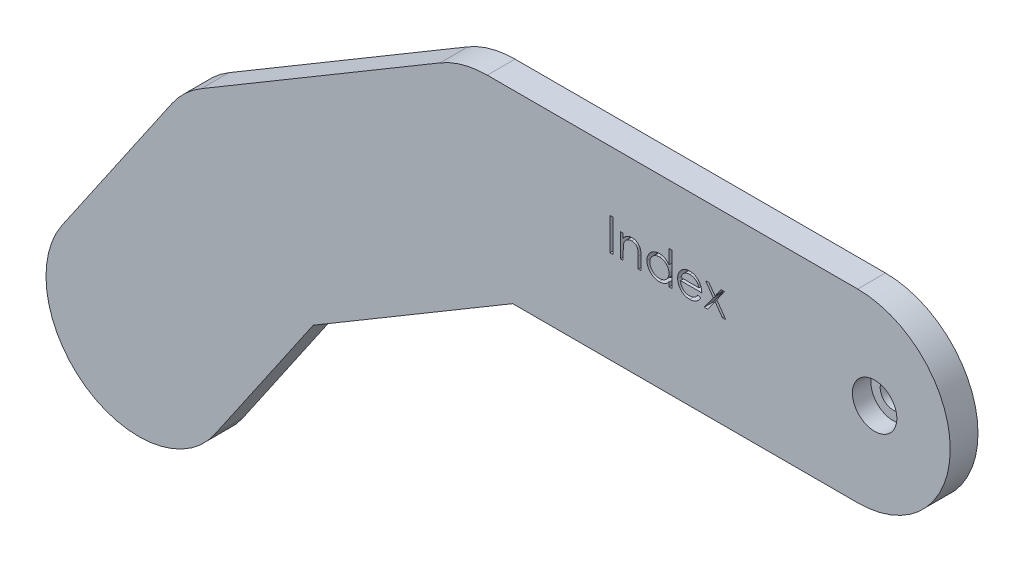
from build123d import *

# Parameters (mm, degrees)
BOSS_EXTRUDE1_DEPTH = 3
BOSS_EXTRUDE2_DEPTH = 3
BOSS_EXTRUDE4_DEPTH = 3
SKETCH4_R           = 1.4
CUT_EXTRUDE5_DEPTH  = 3
SKETCH5_R           = 2.4
CUT_EXTRUDE6_DEPTH  = 2
SKETCH7_W           = 0.314102564
SKETCH7_H           = 3.5
CUT_EXTRUDE7_DEPTH  = 1


with BuildPart() as part:
    # Sketch1 → Boss-Extrude1 (new body)
    with BuildSketch(Plane.XY):
        with BuildLine():
            Line((0, 10), (40, 10))
            ThreePointArc((40, 10), (50, 0), (40, -10))
            Line((40, -10), (0, -10))
            ThreePointArc((0, -10), (-10, 0), (0, 10))
        make_face()
    extrude(amount=BOSS_EXTRUDE1_DEPTH)

    # Sketch2 → Boss-Extrude2 (add)
    with BuildSketch(Plane.XY):
        with BuildLine():
            Line((5.104260767, -8.599216361), (-20.693388315, -23.911998663))
            ThreePointArc((-20.693388315, -23.911998663), (-34.396865443, -20.417043069), (-30.90190985, -6.713565941))
            Line((-30.90190985, -6.713565941), (-5.104260767, 8.599216361))
            ThreePointArc((-5.104260767, 8.599216361), (8.599216361, 5.104260767), (5.104260767, -8.599216361))
        make_face()
    extrude(amount=BOSS_EXTRUDE2_DEPTH)

    # Sketch3 → Boss-Extrude4 (add)
    with BuildSketch(Plane.XY):
        with BuildLine():
            Line((-17.548569958, -20.965453669), (-29.412835261, -38.27926105))
            ThreePointArc((-29.412835261, -38.27926105), (-43.314585753, -40.875668807), (-45.910993511, -26.973918315))
            Line((-45.910993511, -26.973918315), (-34.046728207, -9.660110934))
            ThreePointArc((-34.046728207, -9.660110934), (-20.144977715, -7.063703177), (-17.548569958, -20.965453669))
        make_face()
    extrude(amount=BOSS_EXTRUDE4_DEPTH)

    # Sketch4 → Cut-Extrude5 (cut)
    with BuildSketch(Plane.XY):
        with Locations((41.835442891, 0)):
            Circle(SKETCH4_R)
    extrude(amount=CUT_EXTRUDE5_DEPTH, mode=Mode.SUBTRACT)

    # Sketch5 → Cut-Extrude6 (cut)
    with BuildSketch(Plane.XY.offset(3)):
        with Locations((41.835442891, 0)):
            Circle(SKETCH5_R)
    extrude(amount=-CUT_EXTRUDE6_DEPTH, mode=Mode.SUBTRACT)

    # Sketch7 → Cut-Extrude7 (cut)
    # profile 1 of 5: a face of its own
    with BuildSketch(Plane.XY.offset(3)):
        with Locations((13.404825066, 1.760445417)):
            Rectangle(SKETCH7_W, SKETCH7_H)
    # profile 2 of 5: a face of its own
    with BuildSketch(Plane.XY.offset(3)):
        with BuildLine():
            Line((14.369568655, 2.568137725), (14.683671219, 2.568137725))
            Line((14.683671219, 2.568137725), (14.683671219, 2.106799584))
            add(Edge.make_bspline(
                [(14.683671219, 2.106799584), (14.717208855, 2.148642307), (14.782289806, 2.22983957), (14.890674139, 2.336560145), (15.005218039, 2.42450537), (15.125220043, 2.494609164), (15.250843053, 2.54745579), (15.381321323, 2.585621721), (15.517436029, 2.60850655), (15.610000466, 2.61149678), (15.656828271, 2.61300952)],
                knots=[0, 0, 0, 0, 1.12780773, 2.188550248, 3.19190651, 4.159438251, 5.104880172, 6.052711206, 7.014878035, 8, 8, 8, 8], degree=3))
            add(Edge.make_bspline(
                [(15.656828271, 2.61300952), (15.704158905, 2.611264325), (15.796796373, 2.607848556), (15.931674434, 2.580831865), (16.057647828, 2.53468661), (16.174267383, 2.471474539), (16.279394597, 2.392868066), (16.371719448, 2.301290284), (16.448082696, 2.195954201), (16.499280059, 2.098231045), (16.533005706, 2.011542251), (16.554238044, 1.9372955), (16.572269025, 1.854577349), (16.587900773, 1.76363776), (16.598477885, 1.66383957), (16.606820177, 1.555591878), (16.612798871, 1.438929747), (16.613036078, 1.35824312), (16.613158399, 1.316635321)],
                knots=[0, 0, 0, 0, 1.235846778, 2.418850247, 3.575807741, 4.728682307, 5.871620074, 6.994088408, 8.11269785, 9.256955736, 9.865816715, 10.540099792, 11.271859618, 12.076849838, 12.949306005, 13.892391288, 14.913166135, 16, 16, 16, 16], degree=3))
            Line((16.613158399, 1.316635321), (16.613158399, 0.010445417))
            Line((16.613158399, 0.010445417), (16.299055835, 0.010445417))
            Line((16.299055835, 0.010445417), (16.299055835, 1.213570417))
            add(Edge.make_bspline(
                [(16.299055835, 1.213570417), (16.298862627, 1.248392862), (16.298493053, 1.315002273), (16.297327406, 1.410371296), (16.294517599, 1.496857875), (16.290569287, 1.574255242), (16.284790256, 1.642489079), (16.278767625, 1.701698355), (16.271402648, 1.751807898), (16.264839735, 1.78197298), (16.26189638, 1.795501507)],
                knots=[0, 0, 0, 0, 1.430800155, 2.736877192, 3.918605307, 4.986035426, 5.920637409, 6.731861385, 7.431261377, 8, 8, 8, 8], degree=3))
            add(Edge.make_bspline(
                [(16.26189638, 1.795501507), (16.251270848, 1.835212692), (16.230819988, 1.911644437), (16.180286004, 2.015318789), (16.116471824, 2.103516977), (16.038573974, 2.175693699), (15.947344899, 2.231864536), (15.843037756, 2.27083849), (15.726659115, 2.295214759), (15.644804732, 2.297641891), (15.602140771, 2.298906956)],
                knots=[0, 0, 0, 0, 1.084156227, 2.086665306, 3.027808233, 3.945421172, 4.874247719, 5.839848303, 6.874090471, 8, 8, 8, 8], degree=3))
            add(Edge.make_bspline(
                [(15.602140771, 2.298906956), (15.576873087, 2.298430951), (15.526868994, 2.29748895), (15.452719022, 2.288037652), (15.380794849, 2.272579197), (15.31037464, 2.251710559), (15.242866846, 2.22304829), (15.176102555, 2.19051892), (15.112595791, 2.149970708), (15.050992394, 2.104780086), (14.993679586, 2.054700879), (14.940351248, 2.001856369), (14.892813228, 1.945580765), (14.849744552, 1.886780818), (14.812566289, 1.82464898), (14.780113201, 1.759784673), (14.752577506, 1.692102524), (14.738894814, 1.645127463), (14.732048623, 1.621623302)],
                knots=[0, 0, 0, 0, 1.023777757, 2.026029729, 3.023749952, 4.003683103, 4.997618607, 5.993177895, 7.010360494, 8.046726602, 9.087585522, 10.09234134, 11.086953743, 12.070360549, 13.043493632, 14.017870808, 15.008233677, 16, 16, 16, 16], degree=3))
            add(Edge.make_bspline(
                [(14.732048623, 1.621623302), (14.728108975, 1.604368099), (14.719532566, 1.566804425), (14.710269386, 1.505160005), (14.701861811, 1.43385003), (14.694824852, 1.352957713), (14.690519435, 1.262199838), (14.685825039, 1.161964), (14.684115978, 1.051850512), (14.683823624, 0.975188819), (14.683671219, 0.935225065)],
                knots=[0, 0, 0, 0, 0.615963638, 1.340920617, 2.168419149, 3.115676021, 4.16674242, 5.331190069, 6.6087489, 8, 8, 8, 8], degree=3))
            Line((14.683671219, 0.935225065), (14.683671219, 0.010445417))
            Line((14.683671219, 0.010445417), (14.369568655, 0.010445417))
            Line((14.369568655, 0.010445417), (14.369568655, 2.568137725))
        make_face()
    # profile 3 of 5: a face of its own
    with BuildSketch(Plane.XY.offset(3)):
        with BuildLine():
            Line((19.933671219, 3.600189007), (19.933671219, 0.010445417))
            Line((19.933671219, 0.010445417), (19.619568655, 0.010445417))
            Line((19.619568655, 0.010445417), (19.619568655, 0.45285327))
            add(Edge.make_bspline(
                [(19.619568655, 0.45285327), (19.584149865, 0.412813676), (19.515029649, 0.334675905), (19.399588531, 0.232593732), (19.277220354, 0.148215411), (19.148519032, 0.080065495), (19.013600789, 0.028873439), (18.872764702, -0.00751272), (18.725953321, -0.030906555), (18.625700966, -0.033242577), (18.574897181, -0.034426377)],
                knots=[0, 0, 0, 0, 1.074387032, 2.096679803, 3.090159297, 4.057316773, 5.018401886, 5.985159533, 6.978961417, 8, 8, 8, 8], degree=3))
            add(Edge.make_bspline(
                [(18.574897181, -0.034426377), (18.529729227, -0.033200005), (18.440656022, -0.030781545), (18.309626945, -0.012019241), (18.183534696, 0.01811138), (18.062260123, 0.06001227), (17.946587978, 0.115593092), (17.835527881, 0.18213434), (17.729655189, 0.26137517), (17.63058365, 0.351963198), (17.53935165, 0.450358185), (17.459290377, 0.555303732), (17.392537297, 0.666346036), (17.336717216, 0.78207919), (17.293720872, 0.903394109), (17.263747238, 1.029871277), (17.245006791, 1.161361151), (17.24258933, 1.250900674), (17.241363527, 1.296302789)],
                knots=[0, 0, 0, 0, 1.033919861, 2.038935746, 3.024066025, 3.998881131, 4.97069526, 5.957263378, 6.95902576, 7.993208707, 9.027059324, 10.027763471, 11.009749337, 11.988697705, 12.965288445, 13.950418724, 14.960734635, 16, 16, 16, 16], degree=3))
            add(Edge.make_bspline(
                [(17.241363527, 1.296302789), (17.242616499, 1.340766493), (17.245093555, 1.428668836), (17.263546775, 1.557947534), (17.294577784, 1.682465795), (17.338125632, 1.801822738), (17.393967586, 1.916162788), (17.461895673, 2.025566813), (17.541914798, 2.130336211), (17.634167205, 2.228007437), (17.734101975, 2.318228052), (17.841010706, 2.396637097), (17.952233988, 2.464353946), (18.069496998, 2.518007422), (18.191064103, 2.561416527), (18.318017549, 2.591449495), (18.449829127, 2.609146816), (18.539319619, 2.61170958), (18.584712886, 2.61300952)],
                knots=[0, 0, 0, 0, 1.020392517, 2.01726096, 2.990465484, 3.961182959, 4.928053699, 5.906110375, 6.912531644, 7.948652711, 8.985773172, 9.998621852, 10.987621588, 11.969261332, 12.953316658, 13.946091881, 14.958173133, 16, 16, 16, 16], degree=3))
            add(Edge.make_bspline(
                [(18.584712886, 2.61300952), (18.636929694, 2.611442424), (18.739425484, 2.608366389), (18.889324006, 2.582660022), (19.031111617, 2.539497144), (19.165604604, 2.480405862), (19.292001164, 2.403605111), (19.411227805, 2.310853663), (19.521211128, 2.199526517), (19.58628295, 2.115914944), (19.619568655, 2.073145738)],
                knots=[0, 0, 0, 0, 1.031072012, 2.023879775, 2.993683497, 3.952812103, 4.918022106, 5.908088563, 6.929940113, 8, 8, 8, 8], degree=3))
            Line((19.619568655, 2.073145738), (19.619568655, 3.600189007))
            Line((19.619568655, 3.600189007), (19.933671219, 3.600189007))
        make_face()
        with BuildLine():
            add(Edge.make_bspline(
                [(18.588919617, 2.298906956), (18.543005279, 2.297273318), (18.452377679, 2.294048777), (18.319333677, 2.268875282), (18.192020263, 2.226990688), (18.071074189, 2.169708786), (17.958405972, 2.09768005), (17.857712301, 2.010558666), (17.7681696, 1.910721652), (17.692861336, 1.798619542), (17.631470839, 1.678441451), (17.588303807, 1.552817013), (17.559834559, 1.424012035), (17.556926039, 1.336649349), (17.555466091, 1.29279718)],
                knots=[0, 0, 0, 0, 1.031046209, 2.035121221, 3.029706178, 4.034933723, 5.034054252, 6.02443088, 7.017295772, 8.038157696, 9.050218397, 10.03989886, 11.016116709, 12, 12, 12, 12], degree=3))
            add(Edge.make_bspline(
                [(17.555466091, 1.29279718), (17.557330985, 1.249207073), (17.561053461, 1.162197717), (17.587804156, 1.03321714), (17.632684029, 0.907563098), (17.693926092, 0.786302105), (17.770612717, 0.673718004), (17.859501369, 0.571977882), (17.961451651, 0.484488294), (18.074379158, 0.41125072), (18.194987128, 0.352088199), (18.32182106, 0.31092256), (18.452496698, 0.284344779), (18.541349032, 0.281240302), (18.58611513, 0.279676187)],
                knots=[0, 0, 0, 0, 0.979072187, 1.954306742, 2.945804271, 3.96968567, 4.997920485, 5.998718438, 6.996577872, 8.005894225, 9.015743152, 10.005417472, 10.995077863, 12, 12, 12, 12], degree=3))
            add(Edge.make_bspline(
                [(18.58611513, 0.279676187), (18.631561632, 0.281336151), (18.721950219, 0.284637654), (18.855388927, 0.309918919), (18.98488389, 0.351687718), (19.108671118, 0.409586845), (19.223987249, 0.4813442), (19.327485127, 0.565351291), (19.415001095, 0.663054476), (19.489193705, 0.770430929), (19.547369121, 0.888142925), (19.589745181, 1.013477116), (19.614799086, 1.146437864), (19.617956816, 1.237301791), (19.619568655, 1.283682597)],
                knots=[0, 0, 0, 0, 1.01762866, 2.023962475, 3.030623092, 4.058876274, 5.077231937, 6.066672613, 7.034107872, 8.005628644, 8.981990164, 9.965428785, 10.961468474, 12, 12, 12, 12], degree=3))
            add(Edge.make_bspline(
                [(19.619568655, 1.283682597), (19.618608999, 1.319020427), (19.616720092, 1.388576461), (19.602289522, 1.490703978), (19.579334596, 1.588437704), (19.546988426, 1.681880393), (19.504497141, 1.770515409), (19.453249375, 1.854979169), (19.392343926, 1.93483238), (19.322761229, 2.008975451), (19.246596027, 2.076601914), (19.166001486, 2.136966154), (19.080022739, 2.186554927), (18.990105702, 2.227596199), (18.896094368, 2.260255348), (18.797223748, 2.282043042), (18.694544761, 2.297003363), (18.624498706, 2.298265744), (18.588919617, 2.298906956)],
                knots=[0, 0, 0, 0, 1.050140795, 2.067009409, 3.05949893, 4.030605086, 5.00011959, 5.97591094, 6.962425594, 7.979863591, 8.993523472, 9.986985069, 10.967611495, 11.937549037, 12.921786183, 13.919465291, 14.943216303, 16, 16, 16, 16], degree=3))
        make_face(mode=Mode.SUBTRACT)
    # profile 4 of 5: a face of its own
    with BuildSketch(Plane.XY.offset(3)):
        with BuildLine():
            Line((22.750778591, 0.818137725), (23.029825066, 0.67160327))
            add(Edge.make_bspline(
                [(23.029825066, 0.67160327), (23.00758847, 0.632159939), (22.964324862, 0.555418836), (22.889924114, 0.449986975), (22.811932041, 0.35513926), (22.726828073, 0.273409605), (22.637158394, 0.20215822), (22.54242574, 0.139820396), (22.442136922, 0.086701875), (22.336287197, 0.041949347), (22.223987646, 0.007539853), (22.10496613, -0.016764368), (21.978994634, -0.031787636), (21.892648454, -0.033532777), (21.848434841, -0.034426377)],
                knots=[0, 0, 0, 0, 1.120438281, 2.179929193, 3.190490725, 4.156257408, 5.095198341, 6.022838206, 6.959905092, 7.901321166, 8.864066838, 9.862729781, 10.905609505, 12, 12, 12, 12], degree=3))
            add(Edge.make_bspline(
                [(21.848434841, -0.034426377), (21.799292864, -0.033279202), (21.703431102, -0.031041395), (21.563891355, -0.011748931), (21.432511937, 0.019723428), (21.309300233, 0.063688969), (21.194557981, 0.121116293), (21.088057126, 0.191075775), (20.9892376, 0.27320803), (20.901213391, 0.368224473), (20.821969508, 0.469906431), (20.752043688, 0.575862315), (20.693586257, 0.68582554), (20.646033647, 0.799096064), (20.607628782, 0.914959957), (20.580862078, 1.034471425), (20.56543233, 1.157307009), (20.563067885, 1.240404345), (20.561876348, 1.282280353)],
                knots=[0, 0, 0, 0, 1.145258523, 2.234067595, 3.276747158, 4.290159414, 5.277019952, 6.260822364, 7.254936242, 8.264827045, 9.274100331, 10.257902744, 11.220704747, 12.172965371, 13.118907548, 14.062713208, 15.023725156, 16, 16, 16, 16], degree=3))
            add(Edge.make_bspline(
                [(20.561876348, 1.282280353), (20.562935489, 1.321575184), (20.565034567, 1.399452348), (20.578265355, 1.514717893), (20.601713648, 1.626746345), (20.633889972, 1.735630793), (20.675441218, 1.841188927), (20.726273437, 1.943484991), (20.786465815, 2.042410131), (20.832938489, 2.104813265), (20.856347501, 2.136246699)],
                knots=[0, 0, 0, 0, 1.024358464, 2.0301432, 3.019427413, 4.004406732, 4.986367066, 5.972626655, 6.978780325, 8, 8, 8, 8], degree=3))
            add(Edge.make_bspline(
                [(20.856347501, 2.136246699), (20.888055184, 2.17411557), (20.950466131, 2.24865372), (21.056022486, 2.346592046), (21.170322683, 2.428635821), (21.291934309, 2.496642957), (21.422270783, 2.548316604), (21.559580074, 2.586824186), (21.70542566, 2.608402197), (21.805130881, 2.611450031), (21.856147181, 2.61300952)],
                knots=[0, 0, 0, 0, 1.030682036, 2.02871468, 2.997146059, 3.962720338, 4.930598197, 5.918074684, 6.934738563, 8, 8, 8, 8], degree=3))
            add(Edge.make_bspline(
                [(21.856147181, 2.61300952), (21.908594786, 2.611655471), (22.011485032, 2.608999136), (22.161517153, 2.584372802), (22.30347787, 2.545320248), (22.437310374, 2.490166457), (22.563028235, 2.419006906), (22.679814284, 2.330865064), (22.789665797, 2.228446977), (22.853574376, 2.149683767), (22.886095098, 2.109604071)],
                knots=[0, 0, 0, 0, 1.056321875, 2.072262726, 3.055038591, 4.01806755, 4.982017516, 5.957941055, 6.960871419, 8, 8, 8, 8], degree=3))
            add(Edge.make_bspline(
                [(22.886095098, 2.109604071), (22.908222036, 2.07940049), (22.952328629, 2.019194371), (23.007575729, 1.921023214), (23.055533124, 1.81831262), (23.093866085, 1.709402323), (23.124905586, 1.595582742), (23.147362405, 1.476040198), (23.160532024, 1.350810286), (23.163120721, 1.265483731), (23.16444045, 1.221983879)],
                knots=[0, 0, 0, 0, 0.94817472, 1.890038105, 2.849395472, 3.817997239, 4.812318967, 5.836947057, 6.897266129, 8, 8, 8, 8], degree=3))
            Line((23.16444045, 1.221983879), (20.875978912, 1.221983879))
            add(Edge.make_bspline(
                [(20.875978912, 1.221983879), (20.877518518, 1.188283415), (20.880546092, 1.122012811), (20.894661235, 1.025042028), (20.916910009, 0.932668686), (20.948179072, 0.845585644), (20.986045917, 0.762655516), (21.032431634, 0.684493479), (21.087771188, 0.611455549), (21.149496887, 0.542888412), (21.218203982, 0.48182765), (21.29048673, 0.427175874), (21.367380295, 0.381370277), (21.448278378, 0.344190388), (21.533050163, 0.315084072), (21.621722358, 0.295216251), (21.714120475, 0.281909144), (21.777106209, 0.280429479), (21.809172021, 0.279676187)],
                knots=[0, 0, 0, 0, 1.094153842, 2.151609401, 3.174256925, 4.172055639, 5.149267565, 6.128595816, 7.11444997, 8.118368179, 9.117203808, 10.09244225, 11.054858984, 12.015122123, 12.976791628, 13.957293641, 14.960065497, 16, 16, 16, 16], degree=3))
            add(Edge.make_bspline(
                [(21.809172021, 0.279676187), (21.840523168, 0.280284243), (21.902729859, 0.281490744), (21.995370717, 0.293222655), (22.086510244, 0.312192931), (22.175771227, 0.338082921), (22.261342073, 0.369659773), (22.340587623, 0.407762631), (22.413467839, 0.449912377), (22.481584805, 0.498122053), (22.547655799, 0.55713024), (22.613198285, 0.630765961), (22.683474939, 0.717853488), (22.727464531, 0.783399154), (22.750778591, 0.818137725)],
                knots=[0, 0, 0, 0, 0.99110716, 1.966546729, 2.947904876, 3.932708344, 4.903319531, 5.828989031, 6.710028674, 7.56322171, 8.463672341, 9.504779593, 10.677557249, 12, 12, 12, 12], degree=3))
        make_face()
        with BuildLine():
            add(Edge.make_bspline(
                [(22.850337886, 1.536086443), (22.838841262, 1.577749317), (22.81671396, 1.657936937), (22.770477596, 1.768977828), (22.718406055, 1.867665729), (22.656784324, 1.953245362), (22.586965598, 2.029248875), (22.506320415, 2.09566746), (22.415884522, 2.155084911), (22.316125381, 2.205237411), (22.210483596, 2.247927269), (22.099877404, 2.276552385), (21.987019616, 2.296161927), (21.91068533, 2.297988036), (21.872272982, 2.298906956)],
                knots=[0, 0, 0, 0, 1.154881502, 2.222775134, 3.210006277, 4.132804581, 5.035138423, 5.962687519, 6.919655026, 7.923214229, 8.944639381, 9.960483929, 10.97369054, 12, 12, 12, 12], degree=3))
            add(Edge.make_bspline(
                [(21.872272982, 2.298906956), (21.840923544, 2.298295284), (21.778952295, 2.297086138), (21.687651226, 2.285616009), (21.599971528, 2.266656164), (21.51526624, 2.240691207), (21.434645372, 2.206082605), (21.356450603, 2.165499378), (21.282670207, 2.115957795), (21.236528912, 2.07819894), (21.213218495, 2.059123302)],
                knots=[0, 0, 0, 0, 1.04873581, 2.073130211, 3.073294108, 4.04793562, 5.032784715, 6.005352987, 6.992311501, 8, 8, 8, 8], degree=3))
            add(Edge.make_bspline(
                [(21.213218495, 2.059123302), (21.196525213, 2.044028986), (21.162742079, 2.01348177), (21.117601557, 1.960852564), (21.074381085, 1.904101002), (21.035047432, 1.841055877), (20.998969845, 1.772435098), (20.965209868, 1.698817463), (20.934823456, 1.619644333), (20.917727346, 1.564471893), (20.908931636, 1.536086443)],
                knots=[0, 0, 0, 0, 0.879870761, 1.780643979, 2.707998968, 3.669668524, 4.684282772, 5.740141944, 6.837334558, 8, 8, 8, 8], degree=3))
            Line((20.908931636, 1.536086443), (22.850337886, 1.536086443))
        make_face(mode=Mode.SUBTRACT)
    # profile 5 of 5: a face of its own
    with BuildSketch(Plane.XY.offset(3)):
        Polygon((23.568286604, 2.568137725), (23.941984521, 2.568137725), (24.600337886, 1.645461443), (25.258691251, 2.568137725), (25.632389168, 2.568137725), (24.787537405, 1.383943014), (25.767004553, 0.010445417), (25.393306636, 0.010445417), (24.600337886, 1.121723462), (23.807369136, 0.010445417), (23.433671219, 0.010445417), (24.413839489, 1.383943014), align=None)
    extrude(amount=-CUT_EXTRUDE7_DEPTH, mode=Mode.SUBTRACT)


solid = part.part
